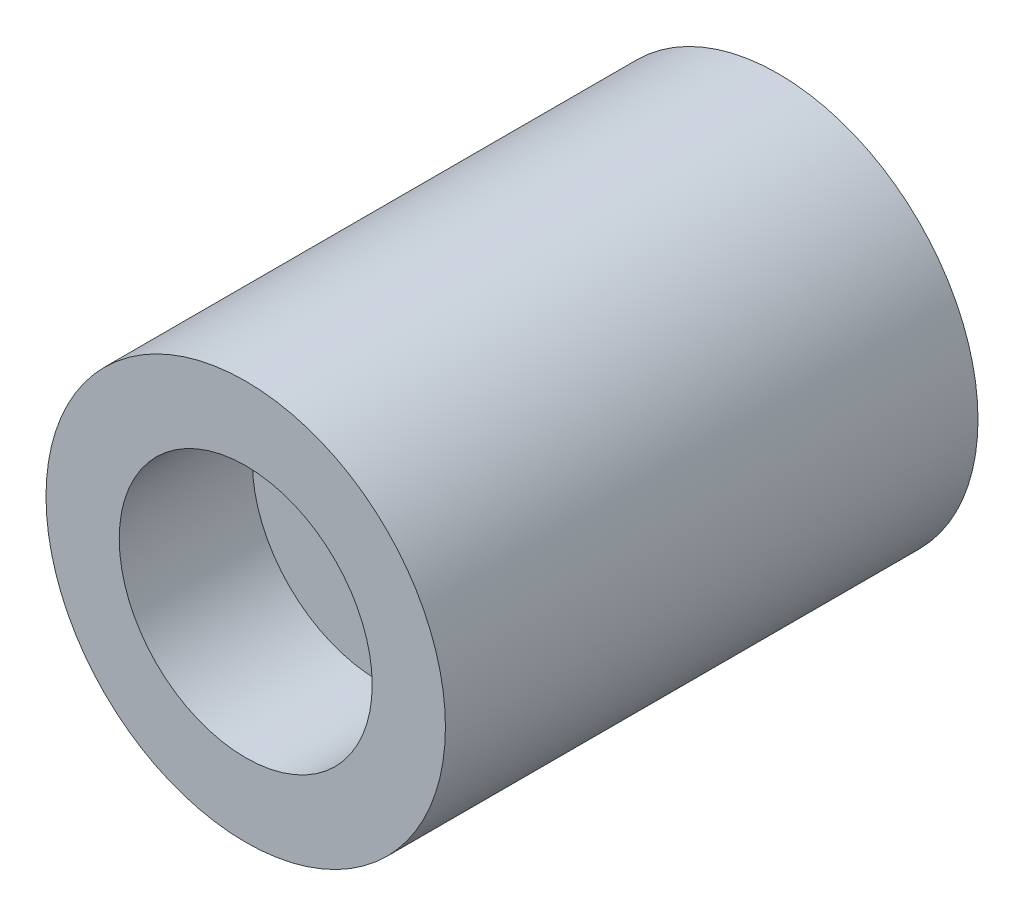
from build123d import *

# Parameters (mm, degrees)
SKETCH1_R           = 3
SKETCH1_R_2         = 1.9
SKETCH1_R_3         = 1.1
BOSS_EXTRUDE1_DEPTH = 8
CUT_EXTRUDE1_START  = 8
SKETCH1_3_R         = 1.9
SKETCH1_3_R_2       = 1.1
CUT_EXTRUDE1_DEPTH  = 2
SKETCH1_4_R         = 1.1
CUT_EXTRUDE2_DEPTH  = 5


with BuildPart() as part:
    # Sketch1 → Boss-Extrude1 (new body)
    # profile 1 of 3: a face of its own
    with BuildSketch(Plane(origin=(0, 0, 0), x_dir=(0, 1, 0), z_dir=(0, 0, 1))):
        with Locations(Location((0, 0, 0), (0, 0, 270))):
            Circle(SKETCH1_R)
        Circle(SKETCH1_R_2, mode=Mode.SUBTRACT)
    # profile 2 of 3: a face of its own
    with BuildSketch(Plane(origin=(0, 0, 0), x_dir=(0, 1, 0), z_dir=(0, 0, 1))):
        Circle(SKETCH1_R_2)
        Circle(SKETCH1_R_3, mode=Mode.SUBTRACT)
    # profile 3 of 3: a face of its own
    with BuildSketch(Plane(origin=(0, 0, 0), x_dir=(0, 1, 0), z_dir=(0, 0, 1))):
        Circle(SKETCH1_R_3)
    extrude(amount=BOSS_EXTRUDE1_DEPTH)

    # Sketch1<3> → Cut-Extrude1 (cut)
    # profile 1 of 2: a face of its own
    with BuildSketch(Plane(origin=(0, 0, 0), x_dir=(0, 1, 0), z_dir=(0, 0, 1)).offset(CUT_EXTRUDE1_START)):
        with Locations(Location((0, 0, 0), (0, 0, 270))):
            Circle(SKETCH1_3_R)
        Circle(SKETCH1_3_R_2, mode=Mode.SUBTRACT)
    # profile 2 of 2: a face of its own
    with BuildSketch(Plane(origin=(0, 0, 0), x_dir=(0, 1, 0), z_dir=(0, 0, 1)).offset(CUT_EXTRUDE1_START)):
        Circle(SKETCH1_3_R_2)
    extrude(amount=-CUT_EXTRUDE1_DEPTH, mode=Mode.SUBTRACT)

    # Sketch1<4> → Cut-Extrude2 (cut)
    with BuildSketch(Plane(origin=(0, 0, 0), x_dir=(0, 1, 0), z_dir=(0, 0, 1))):
        with Locations(Location((0, 0, 0), (0, 0, 270))):
            Circle(SKETCH1_4_R)
    extrude(amount=CUT_EXTRUDE2_DEPTH, mode=Mode.SUBTRACT)


solid = part.part
